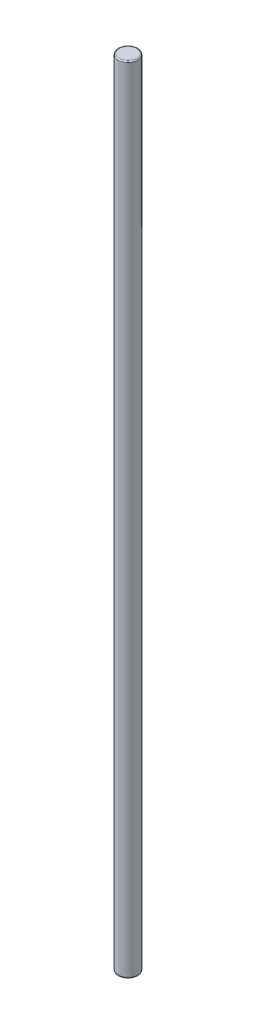
from build123d import *

# Parameters (mm, degrees)
SKETCH1_R           = 4
BOSS_EXTRUDE1_DEPTH = 162.5
FILLET1_R           = 0.5


with BuildPart() as part:
    # Sketch1 → Boss-Extrude1 (new, symmetric)
    with BuildSketch(Plane(origin=(0, 0, 0), x_dir=(1, 0, 0), z_dir=(0, 1, 0))):
        with Locations(Location((0, 0, 0), (0, 0, 270))):
            Circle(SKETCH1_R)
    extrude(amount=BOSS_EXTRUDE1_DEPTH, both=True)

    # Fillet1
    fillet1_edges = [part.edges().sort_by_distance(p)[0] for p in [
        (0, -162.5, -4),
        (0, 162.5, -4),
    ]]
    fillet(fillet1_edges, radius=FILLET1_R)


solid = part.part
